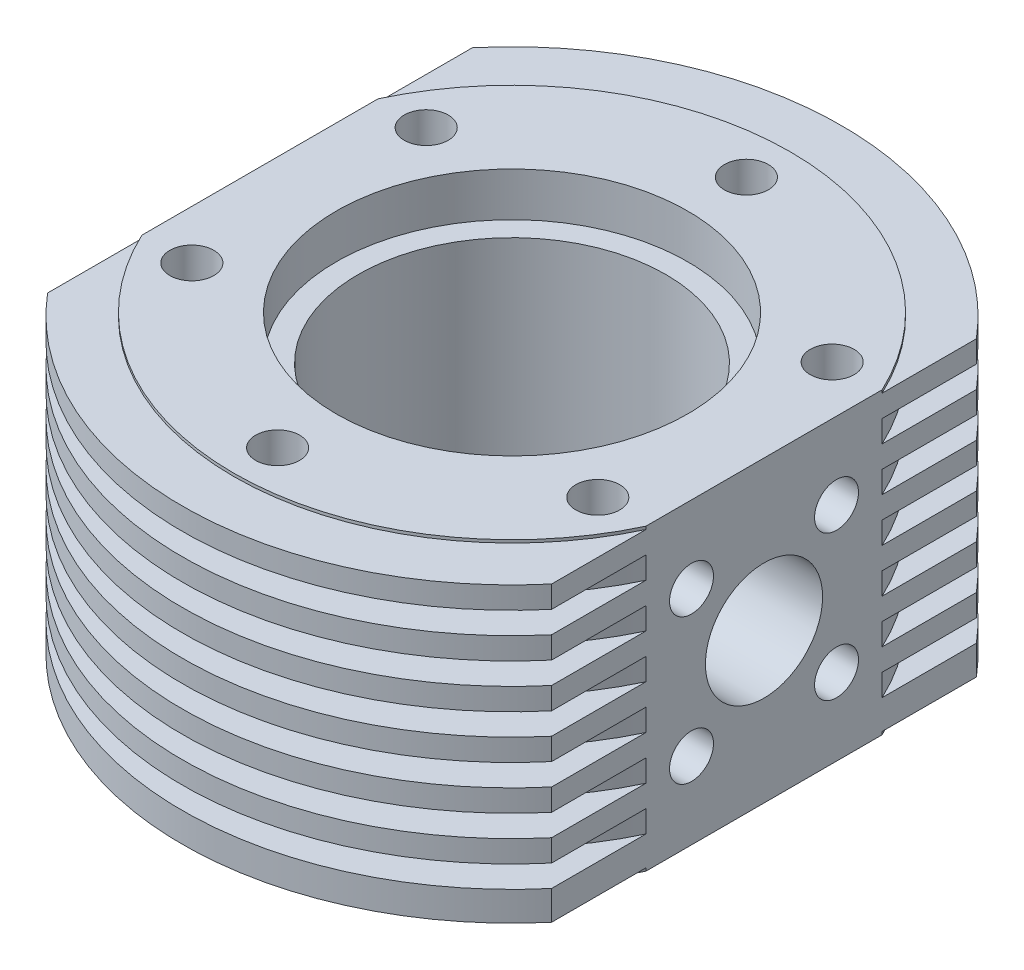
from build123d import *

# Parameters (mm, degrees)
BOSS_EXTRUDE1_DEPTH   = 10
BOSS_EXTRUDE1_2_DEPTH = 10
SKETCH1_4_R           = 1.5
BOSS_EXTRUDE2_DEPTH   = 10.2
SKETCH2_R             = 10.5
CUT_EXTRUDE1_DEPTH    = 35.905730189
SKETCH2_3_R           = 12
CUT_EXTRUDE2_DEPTH    = 3
CUT_EXTRUDE3_DEPTH    = 1.5
LPATTERN2_COUNT       = 6
LPATTERN2_PITCH       = 3
MIRROR1_COPY_1_DEPTH  = 1.5
MIRROR1_COPY_2_DEPTH  = 1.5
MIRROR1_COPY_3_DEPTH  = 1.5
MIRROR1_COPY_4_DEPTH  = 1.5
MIRROR1_COPY_5_DEPTH  = 1.5
MIRROR1_COPY_6_DEPTH  = 1.5
CUT_EXTRUDE4_REACH    = 44.359
SKETCH4_R             = 4
SKETCH5_R             = 1.5
CUT_EXTRUDE5_DEPTH    = 4


with BuildPart() as part:
    # Sketch1 → Boss-Extrude1 (new, symmetric)
    with BuildSketch(Plane(origin=(0, 0, 0), x_dir=(1, 0, 0), z_dir=(0, 1, 0))):
        with BuildLine():
            ThreePointArc((17.204650534, 14.5), (0, 22.5), (-17.204650534, 14.5))
            Line((-17.204650534, 14.5), (-17.204650534, 8.062257748))
            ThreePointArc((-17.204650534, 8.062257748), (0, 19), (17.204650534, 8.062257748))
            Line((17.204650534, 8.062257748), (17.204650534, 14.5))
        make_face()
    extrude(amount=BOSS_EXTRUDE1_DEPTH, both=True)



with BuildPart() as body_2:
    # Sketch1 → Boss-Extrude1 2 (new, symmetric)
    with BuildSketch(Plane(origin=(0, 0, 0), x_dir=(1, 0, 0), z_dir=(0, 1, 0))):
        with BuildLine():
            ThreePointArc((17.204650534, -8.062257748), (0, -19), (-17.204650534, -8.062257748))
            Line((-17.204650534, -8.062257748), (-17.204650534, -14.5))
            ThreePointArc((-17.204650534, -14.5), (0, -22.5), (17.204650534, -14.5))
            Line((17.204650534, -14.5), (17.204650534, -8.062257748))
        make_face()
    extrude(amount=BOSS_EXTRUDE1_2_DEPTH, both=True)


with BuildPart() as part_1:
    add(part.part)

    add(body_2.part)  # Boss-Extrude2 merges body 2
    # Sketch1<4> → Boss-Extrude2 (add, symmetric)
    with BuildSketch(Plane(origin=(0, 0, 0), x_dir=(1, 0, 0), z_dir=(0, 1, 0))):
        with BuildLine():
            ThreePointArc((17.204650534, 8.062257748), (0, 19), (-17.204650534, 8.062257748))
            Line((-17.204650534, 8.062257748), (-17.204650534, -8.062257748))
            ThreePointArc((-17.204650534, -8.062257748), (0, -19), (17.204650534, -8.062257748))
            Line((17.204650534, -8.062257748), (17.204650534, 8.062257748))
        make_face()
        with Locations((-13.856406461, -8)):
            Circle(SKETCH1_4_R, mode=Mode.SUBTRACT)
        with Locations((0, -16)):
            Circle(SKETCH1_4_R, mode=Mode.SUBTRACT)
        with Locations((13.856406461, -8)):
            Circle(SKETCH1_4_R, mode=Mode.SUBTRACT)
        with Locations((-13.856406461, 8)):
            Circle(SKETCH1_4_R, mode=Mode.SUBTRACT)
        with Locations((13.856406461, 8)):
            Circle(SKETCH1_4_R, mode=Mode.SUBTRACT)
        with Locations((0, 16)):
            Circle(SKETCH1_4_R, mode=Mode.SUBTRACT)
    extrude(amount=BOSS_EXTRUDE2_DEPTH, both=True)

    # Sketch2 → Cut-Extrude1 (cut, through all)
    with BuildSketch(Plane(origin=(0, 10.2, 0), x_dir=(1, 0, 0), z_dir=(0, 1, 0))):
        Circle(SKETCH2_R)
    extrude(amount=-CUT_EXTRUDE1_DEPTH, mode=Mode.SUBTRACT)

    # Sketch2<3> → Cut-Extrude2 (cut)
    with BuildSketch(Plane(origin=(0, 10.2, 0), x_dir=(1, 0, 0), z_dir=(0, 1, 0))):
        Circle(SKETCH2_3_R)
    extrude(amount=-CUT_EXTRUDE2_DEPTH, mode=Mode.SUBTRACT)

    # Sketch3 → Cut-Extrude3 (cut)
    with BuildSketch(Plane(origin=(0, 8.5, 0), x_dir=(1, 0, 0), z_dir=(0, 1, 0))):
        with BuildLine():
            Line((17.204650534, 8.062257748), (17.204650534, 14.5))
            ThreePointArc((17.204650534, 14.5), (0, 22.5), (-17.204650534, 14.5))
            Line((-17.204650534, 14.5), (-17.204650534, 8.062257748))
            ThreePointArc((-17.204650534, 8.062257748), (0, 19), (17.204650534, 8.062257748))
        make_face()
    cut_extrude3 = extrude(amount=-CUT_EXTRUDE3_DEPTH, mode=Mode.SUBTRACT)

    # LPattern2: Cut-Extrude3 ×6
    with Locations(*[(0, -i * LPATTERN2_PITCH, 0) for i in range(1, LPATTERN2_COUNT)]):
        add(cut_extrude3, mode=Mode.SUBTRACT)

    # Mirror1 copy 1 sketch → Mirror1 copy 1 (cut)
    with BuildSketch(Plane(origin=(0, 5.5, 0), x_dir=(1, 0, 0), z_dir=(0, 1, 0))):
        with BuildLine():
            Line((17.204650534, -8.062257748), (17.204650534, -14.5))
            ThreePointArc((17.204650534, -14.5), (0, -22.5), (-17.204650534, -14.5))
            Line((-17.204650534, -14.5), (-17.204650534, -8.062257748))
            ThreePointArc((-17.204650534, -8.062257748), (0, -19), (17.204650534, -8.062257748))
        make_face()
    extrude(amount=-MIRROR1_COPY_1_DEPTH, mode=Mode.SUBTRACT)

    # Mirror1 copy 2 sketch → Mirror1 copy 2 (cut)
    with BuildSketch(Plane(origin=(0, 2.5, 0), x_dir=(1, 0, 0), z_dir=(0, 1, 0))):
        with BuildLine():
            Line((17.204650534, -8.062257748), (17.204650534, -14.5))
            ThreePointArc((17.204650534, -14.5), (0, -22.5), (-17.204650534, -14.5))
            Line((-17.204650534, -14.5), (-17.204650534, -8.062257748))
            ThreePointArc((-17.204650534, -8.062257748), (0, -19), (17.204650534, -8.062257748))
        make_face()
    extrude(amount=-MIRROR1_COPY_2_DEPTH, mode=Mode.SUBTRACT)

    # Mirror1 copy 3 sketch → Mirror1 copy 3 (cut)
    with BuildSketch(Plane(origin=(0, -0.5, 0), x_dir=(1, 0, 0), z_dir=(0, 1, 0))):
        with BuildLine():
            Line((17.204650534, -8.062257748), (17.204650534, -14.5))
            ThreePointArc((17.204650534, -14.5), (0, -22.5), (-17.204650534, -14.5))
            Line((-17.204650534, -14.5), (-17.204650534, -8.062257748))
            ThreePointArc((-17.204650534, -8.062257748), (0, -19), (17.204650534, -8.062257748))
        make_face()
    extrude(amount=-MIRROR1_COPY_3_DEPTH, mode=Mode.SUBTRACT)

    # Mirror1 copy 4 sketch → Mirror1 copy 4 (cut)
    with BuildSketch(Plane(origin=(0, -3.5, 0), x_dir=(1, 0, 0), z_dir=(0, 1, 0))):
        with BuildLine():
            Line((17.204650534, -8.062257748), (17.204650534, -14.5))
            ThreePointArc((17.204650534, -14.5), (0, -22.5), (-17.204650534, -14.5))
            Line((-17.204650534, -14.5), (-17.204650534, -8.062257748))
            ThreePointArc((-17.204650534, -8.062257748), (0, -19), (17.204650534, -8.062257748))
        make_face()
    extrude(amount=-MIRROR1_COPY_4_DEPTH, mode=Mode.SUBTRACT)

    # Mirror1 copy 5 sketch → Mirror1 copy 5 (cut)
    with BuildSketch(Plane(origin=(0, -6.5, 0), x_dir=(1, 0, 0), z_dir=(0, 1, 0))):
        with BuildLine():
            Line((17.204650534, -8.062257748), (17.204650534, -14.5))
            ThreePointArc((17.204650534, -14.5), (0, -22.5), (-17.204650534, -14.5))
            Line((-17.204650534, -14.5), (-17.204650534, -8.062257748))
            ThreePointArc((-17.204650534, -8.062257748), (0, -19), (17.204650534, -8.062257748))
        make_face()
    extrude(amount=-MIRROR1_COPY_5_DEPTH, mode=Mode.SUBTRACT)

    # Mirror1 copy 6 sketch → Mirror1 copy 6 (cut)
    with BuildSketch(Plane(origin=(0, 8.5, 0), x_dir=(1, 0, 0), z_dir=(0, 1, 0))):
        with BuildLine():
            Line((17.204650534, -8.062257748), (17.204650534, -14.5))
            ThreePointArc((17.204650534, -14.5), (0, -22.5), (-17.204650534, -14.5))
            Line((-17.204650534, -14.5), (-17.204650534, -8.062257748))
            ThreePointArc((-17.204650534, -8.062257748), (0, -19), (17.204650534, -8.062257748))
        make_face()
    extrude(amount=-MIRROR1_COPY_6_DEPTH, mode=Mode.SUBTRACT)

    # Sketch4 → Cut-Extrude4 (cut, up to next)
    with BuildSketch(Plane(origin=(17.204650534, 0, 0), x_dir=(0, 0, -1), z_dir=(1, 0, 0)), mode=Mode.PRIVATE) as cut_extrude4_sk1:
        Circle(SKETCH4_R)
    cut_extrude4_tool1 = extrude(cut_extrude4_sk1.sketch, amount=-CUT_EXTRUDE4_REACH, mode=Mode.PRIVATE) & part_1.part
    add(cut_extrude4_tool1.solids().sort_by_distance((17.204651, 0, 0))[0], mode=Mode.SUBTRACT)

    # Sketch5 → Cut-Extrude5 (cut)
    with BuildSketch(Plane(origin=(17.204650534, 0, 0), x_dir=(0, 0, -1), z_dir=(1, 0, 0))):
        with Locations((4.949747468, 4.949747468)):
            Circle(SKETCH5_R)
        with Locations((4.949747468, -4.949747468)):
            Circle(SKETCH5_R)
        with Locations((-4.949747468, -4.949747468)):
            Circle(SKETCH5_R)
        with Locations((-4.949747468, 4.949747468)):
            Circle(SKETCH5_R)
    cut_extrude5 = extrude(amount=-CUT_EXTRUDE5_DEPTH, mode=Mode.SUBTRACT)

    # Sketch6 → Cut-Revolve1 (revolve, cut)
    with BuildSketch(Plane(origin=(0, 0.2, 0), x_dir=(1, 0, 0), z_dir=(0, 1, 0))):
        Polygon((-17.204650534, -3), (-14.704650534, -3), (-11.704650534, 0), (-17.204650534, 0), align=None)
    revolve(axis=Axis((-11.704650534, 0.2, 0), (-1, 0, 0)), mode=Mode.SUBTRACT)

    # Mirror2: Cut-Extrude5 across plane
    add(cut_extrude5.mirror(Plane(origin=(0, 0, 0), x_dir=(0, 0, 1), z_dir=(1, 0, 0))), mode=Mode.SUBTRACT)


solid = part_1.part
